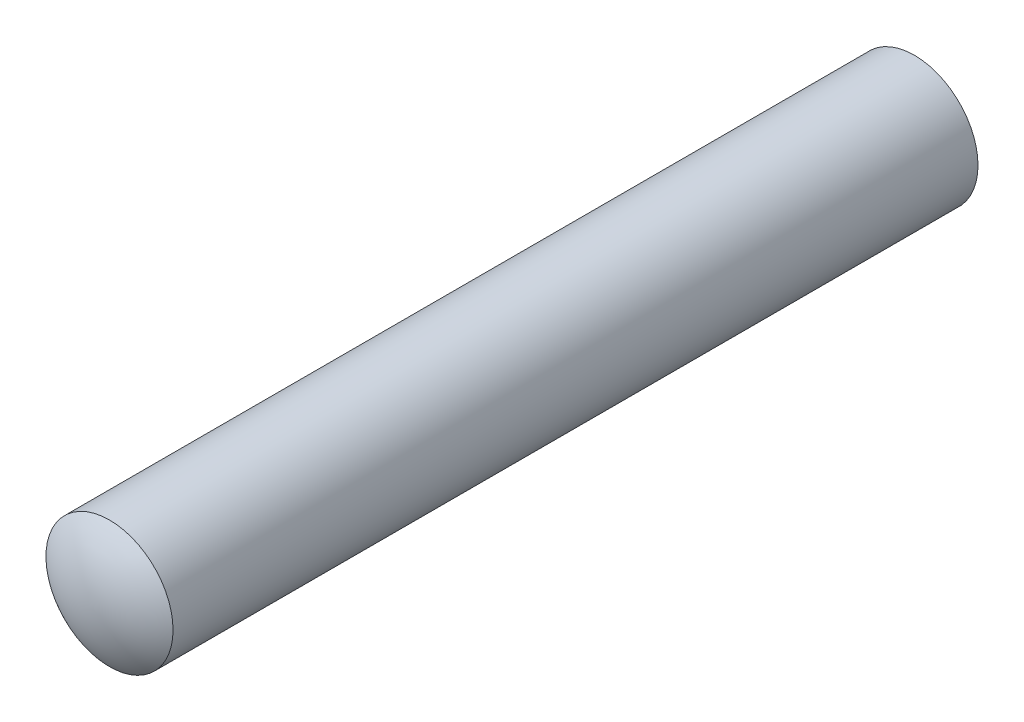
from build123d import *


with BuildPart() as part:
    # 草圖1 → 旋轉1 (revolve)
    with BuildSketch(Plane(origin=(0, 0, 0), x_dir=(0, 0, -1), z_dir=(1, 0, 0))):
        with BuildLine():
            Line((-9.5, 1.5), (9.5, 1.5))
            ThreePointArc((9.5, 1.5), (9.871708245, 0.790569415), (10, 0))
            Line((10, 0), (-10, 0))
            ThreePointArc((-10, 0), (-9.871708245, 0.790569415), (-9.5, 1.5))
        make_face()
    revolve(axis=Axis((0, 0, 10), (0, 0, -1)))


solid = part.part
